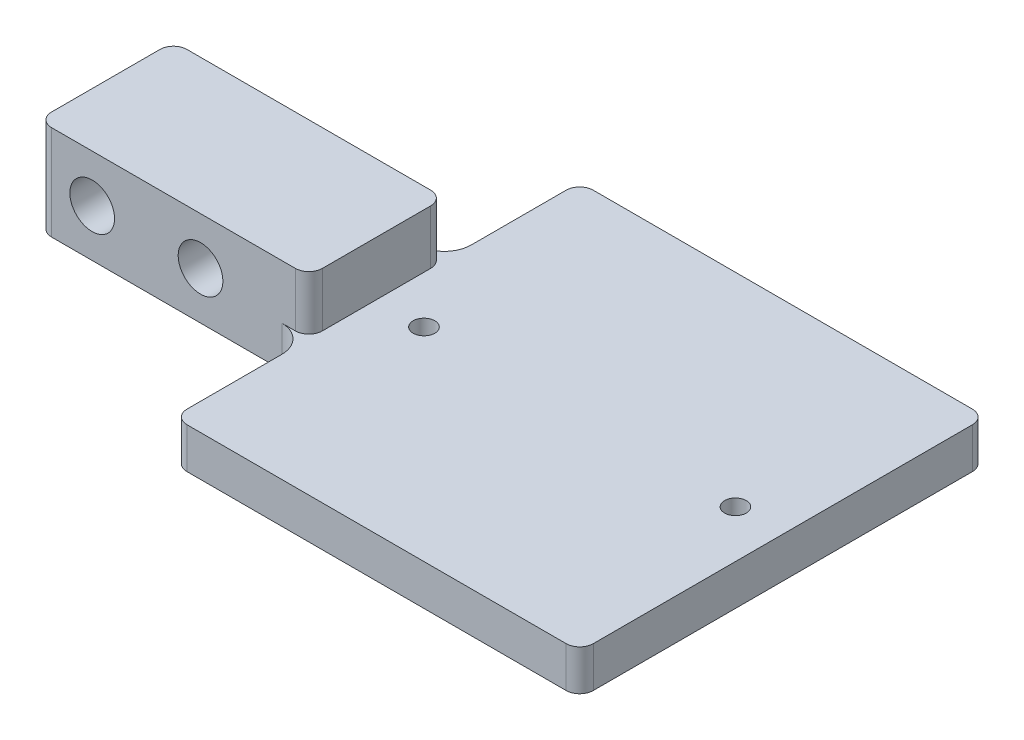
from build123d import *

# Parameters (mm, degrees)
SKETCH1_W             = 30
SKETCH1_H             = 15
BOSS_EXTRUDE1_DEPTH   = 3
SKETCH2_W             = 5
SKETCH2_H             = 7
BOSS_EXTRUDE2_DEPTH   = 20
CUT_EXTRUDE1_DEPTH    = 18
FILLET2_R             = 2
FILLET3_R             = 1
M2X0_4_TAPPED_HOLE1_D = 1.6
M4X0_7_TAPPED_HOLE1_D = 3.3


with BuildPart() as part:
    # Sketch1 → Boss-Extrude1 (new body)
    with BuildSketch(Plane(origin=(0, 0, 0), x_dir=(1, 0, 0), z_dir=(0, 1, 0))):
        with Locations((15, 7.5)):
            Rectangle(SKETCH1_W, SKETCH1_H)
    extrude(amount=BOSS_EXTRUDE1_DEPTH)

    # Sketch2 → Boss-Extrude2 (add)
    with BuildSketch(Plane.ZY):
        with Locations((-12.5, 3.5)):
            Rectangle(SKETCH2_W, SKETCH2_H)
    extrude(amount=BOSS_EXTRUDE2_DEPTH)

    # Sketch3 → Cut-Extrude1 (cut)
    with BuildSketch(Plane.ZY.offset(20)):
        with BuildLine():
            Line((-15, 1), (-15, 6))
            ThreePointArc((-15, 6), (-12.5, 3.5), (-15, 1))
        make_face()
    extrude(amount=-CUT_EXTRUDE1_DEPTH, mode=Mode.SUBTRACT)

    # Mirror1: part across plane


with BuildPart() as part_1:
    add(part.part)
    add(part.part.mirror(Plane(origin=(0, 3, -15), x_dir=(1, 0, 0), z_dir=(0, 0, 1))))

    # Fillet2
    fillet2_edges = [part_1.edges().sort_by_distance(p)[0] for p in [
        (0, 1.5, -10),
        (0, 1.5, -20),
    ]]
    fillet(fillet2_edges, radius=FILLET2_R)

    # Fillet3
    fillet3_edges = [part_1.edges().sort_by_distance(p)[0] for p in [
        (0, 5, -10),
        (-20, 3.5, -10),
        (0, 1.5, -30),
        (30, 1.5, -30),
        (-20, 3.5, -20),
        (0, 5, -20),
        (30, 1.5, 0),
        (0, 1.5, 0),
    ]]
    fillet(fillet3_edges, radius=FILLET3_R)

    # M2x0.4 Tapped Hole1 (through all)
    with Locations(Plane(origin=(3.5, 3, -15), x_dir=(0, 0, 1), z_dir=(0, 1, 0))):
        with Locations((0, 0), (0, 23)):
            Hole(M2X0_4_TAPPED_HOLE1_D / 2)

    # M4x0.7 Tapped Hole1 (through all)
    with Locations(Plane(origin=(-16, 3.5, -10), x_dir=(1, 0, 0), z_dir=(0, 0, 1))):
        with Locations((0, 0), (8, 0)):
            Hole(M4X0_7_TAPPED_HOLE1_D / 2)


solid = part_1.part
